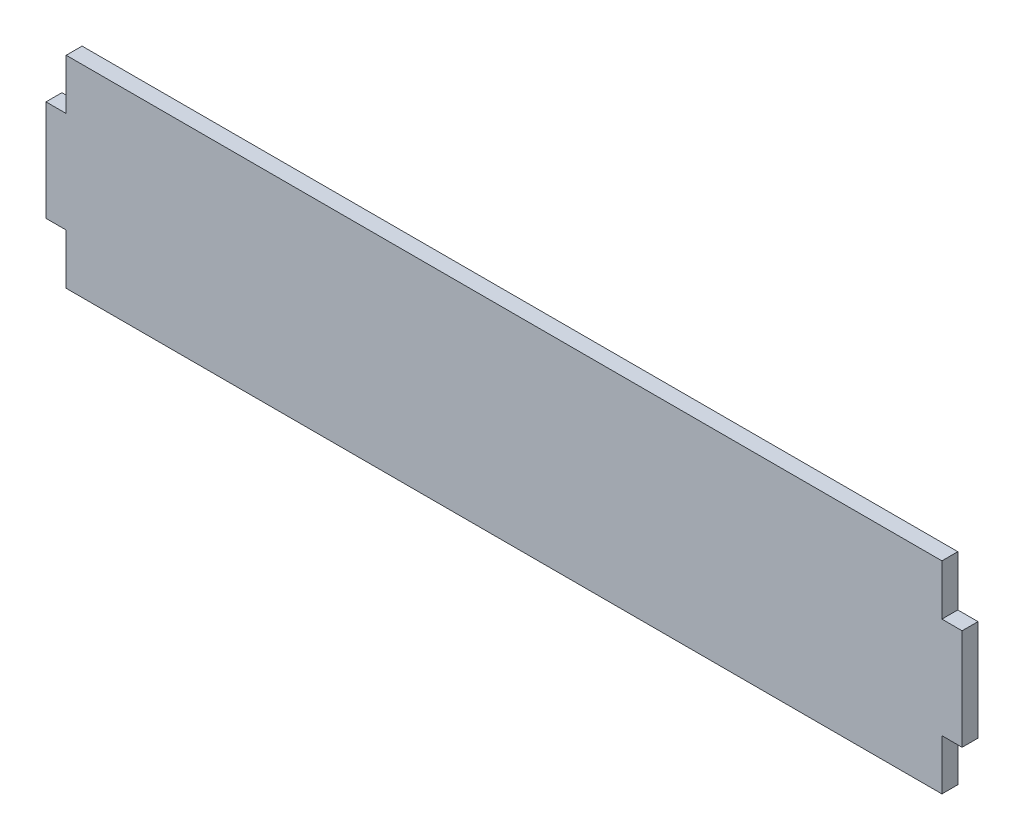
from build123d import *

# Parameters (mm, degrees)
BOSS_EXTRUDE1_DEPTH = 2


with BuildPart() as part:
    # Sketch1 → Boss-Extrude1 (new body)
    with BuildSketch(Plane.XY):
        Polygon((-75.338295952, 22.86), (-75.338295952, 19.05), (-77.878295952, 19.05), (-77.878295952, 6.35), (-75.338295952, 6.35), (-75.338295952, 2.54), (-75.338295952, 0), (34.845630769, 0), (34.845630769, 2.54), (34.845630769, 6.35), (37.385630769, 6.35), (37.385630769, 19.05), (34.845630769, 19.05), (34.845630769, 22.86), (34.845630769, 25.4), (-75.338295952, 25.4), align=None)
    extrude(amount=BOSS_EXTRUDE1_DEPTH)


solid = part.part
